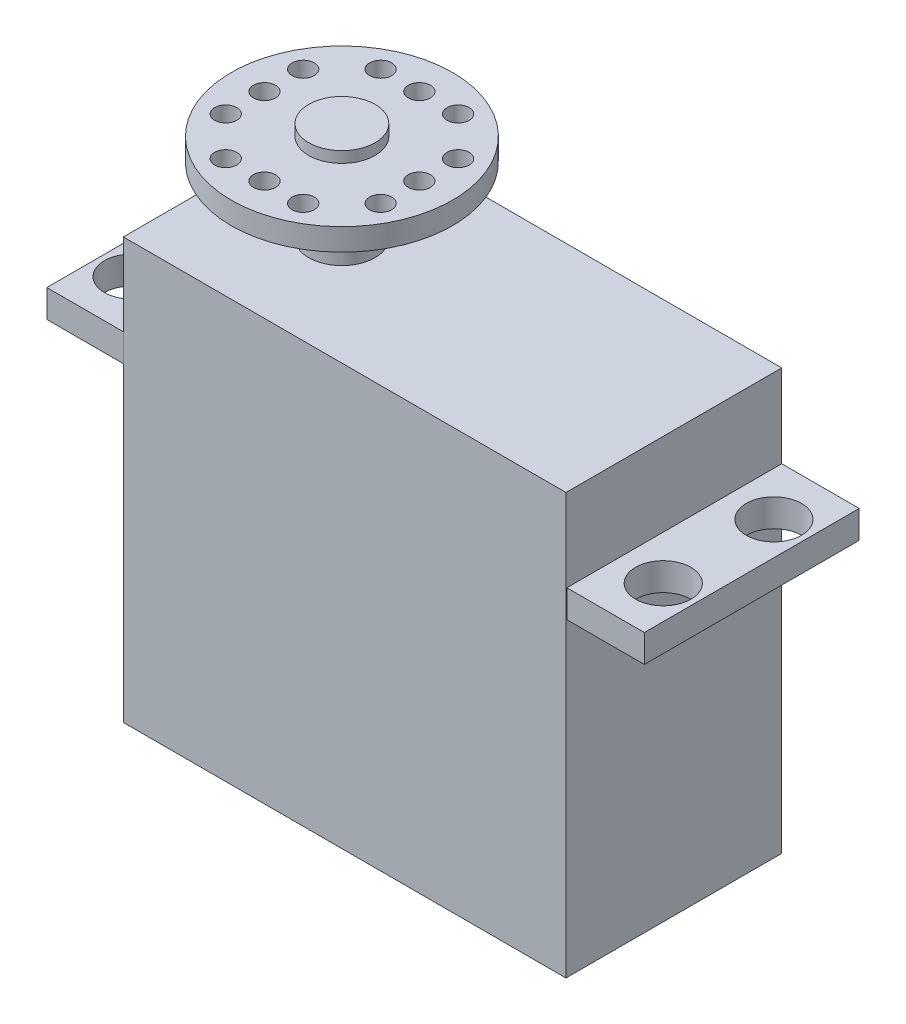
from build123d import *

# Parameters (mm, degrees)
SKETCH_1_W      = 40
SKETCH_1_H      = 38
EXTRUDE_1_DEPTH = 19.5
EXTRUDE_START   = -10
SKETCH_2_W      = 7
SKETCH_2_H      = 19.419635957
SKETCH_2_R      = 2.5
EXTRUDE_2_DEPTH = 2.5
SKETCH_3_R      = 3
EXTRUDE_3_DEPTH = 6
SKETCH_4_R      = 10
SKETCH_4_R_2    = 1
EXTRUDE_4_DEPTH = 2
SKETCH_5_R      = 3
EXTRUDE_5_DEPTH = 1


with BuildPart() as part:
    # 草图1 → 凸台-拉伸1 (new body)
    with BuildSketch(Plane.XY):
        with Locations((20, 19)):
            Rectangle(SKETCH_1_W, SKETCH_1_H)
    extrude(amount=EXTRUDE_1_DEPTH)

    # 草图2 → 凸台-拉伸2 (add)
    # profile 1 of 2: a face of its own
    with BuildSketch(Plane(origin=(0, 38, 0), x_dir=(1, 0, 0), z_dir=(0, 1, 0)).offset(EXTRUDE_START)):
        with Locations((43.5, -9.709817979)):
            Rectangle(SKETCH_2_W, SKETCH_2_H)
        with Locations(Location((44, -4.709817978, 0), (0, 0, 270))):
            Circle(SKETCH_2_R, mode=Mode.SUBTRACT)
        with Locations(Location((44, -14.709817978, 0), (0, 0, 90))):
            Circle(SKETCH_2_R, mode=Mode.SUBTRACT)
    # profile 2 of 2: a face of its own
    with BuildSketch(Plane(origin=(0, 38, 0), x_dir=(1, 0, 0), z_dir=(0, 1, 0)).offset(EXTRUDE_START)):
        with Locations((-3.5, -9.709817979)):
            Rectangle(SKETCH_2_W, SKETCH_2_H)
        with Locations(Location((-4, -14.709817978, 0), (0, 0, 270))):
            Circle(SKETCH_2_R, mode=Mode.SUBTRACT)
        with Locations(Location((-4, -4.709817978, 0), (0, 0, 90))):
            Circle(SKETCH_2_R, mode=Mode.SUBTRACT)
    extrude(amount=EXTRUDE_2_DEPTH)

    # 草图3 → 凸台-拉伸3 (add)
    with BuildSketch(Plane(origin=(0, 38, 0), x_dir=(1, 0, 0), z_dir=(0, 1, 0))):
        with Locations(Location((10, -9.75, 0), (0, 0, 90))):
            Circle(SKETCH_3_R)
    extrude(amount=EXTRUDE_3_DEPTH)

    # 草图4 → 凸台-拉伸4 (add)
    with BuildSketch(Plane(origin=(0, 44, 0), x_dir=(1, 0, 0), z_dir=(0, 1, 0))):
        with Locations(Location((10, -9.75, 0), (0, 0, 270))):
            Circle(SKETCH_4_R)
        with Locations(Location((10, -2.75, 0), (0, 0, 270))):
            Circle(SKETCH_4_R_2, mode=Mode.SUBTRACT)
        with Locations(Location((13.5, -2.75, 0), (0, 0, 270))):
            Circle(SKETCH_4_R_2, mode=Mode.SUBTRACT)
        with Locations(Location((6.5, -2.75, 0), (0, 0, 270))):
            Circle(SKETCH_4_R_2, mode=Mode.SUBTRACT)
        with Locations(Location((6.5, -16.75, 0), (0, 0, 90))):
            Circle(SKETCH_4_R_2, mode=Mode.SUBTRACT)
        with Locations(Location((13.5, -16.75, 0), (0, 0, 90))):
            Circle(SKETCH_4_R_2, mode=Mode.SUBTRACT)
        with Locations(Location((10, -16.75, 0), (0, 0, 90))):
            Circle(SKETCH_4_R_2, mode=Mode.SUBTRACT)
        with Locations(Location((3, -13.25, 0), (0, 0, 270))):
            Circle(SKETCH_4_R_2, mode=Mode.SUBTRACT)
        with Locations(Location((3, -9.75, 0), (0, 0, 270))):
            Circle(SKETCH_4_R_2, mode=Mode.SUBTRACT)
        with Locations(Location((3, -6.25, 0), (0, 0, 270))):
            Circle(SKETCH_4_R_2, mode=Mode.SUBTRACT)
        with Locations(Location((17, -6.25, 0), (0, 0, 90))):
            Circle(SKETCH_4_R_2, mode=Mode.SUBTRACT)
        with Locations(Location((17, -9.75, 0), (0, 0, 90))):
            Circle(SKETCH_4_R_2, mode=Mode.SUBTRACT)
        with Locations(Location((17, -13.25, 0), (0, 0, 90))):
            Circle(SKETCH_4_R_2, mode=Mode.SUBTRACT)
    extrude(amount=EXTRUDE_4_DEPTH)

    # 草图5 → 凸台-拉伸5 (add)
    with BuildSketch(Plane(origin=(0, 46, 0), x_dir=(1, 0, 0), z_dir=(0, 1, 0))):
        with Locations(Location((10, -9.75, 0), (0, 0, 90))):
            Circle(SKETCH_5_R)
    extrude(amount=EXTRUDE_5_DEPTH)


solid = part.part
